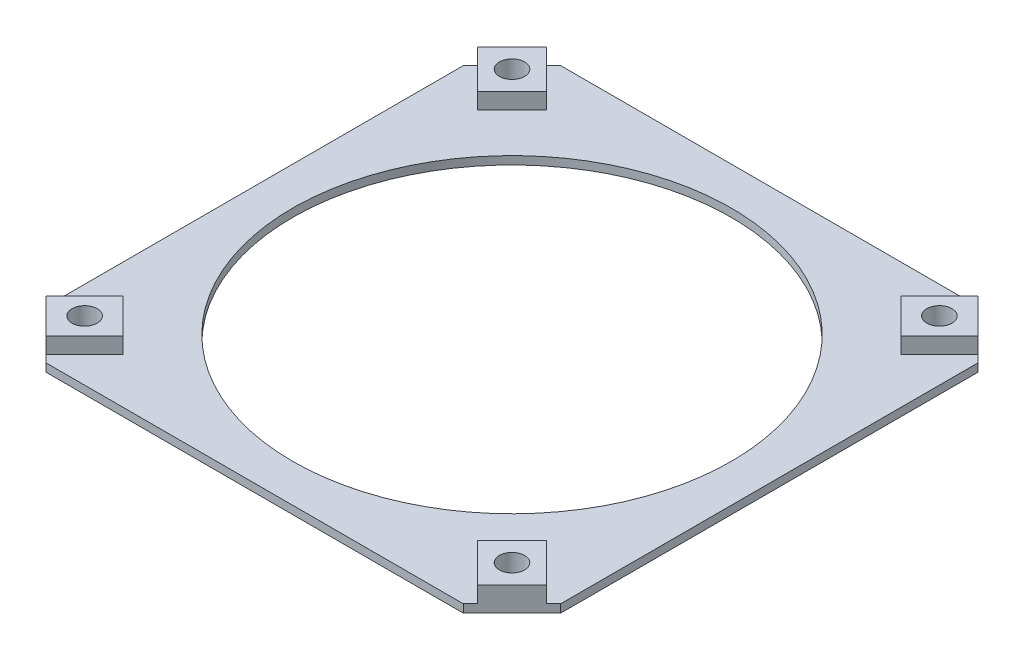
from build123d import *

# Parameters (mm, degrees)
SKETCH1_R            = 27
BOSS_EXTRUDE1_DEPTH  = 1
BOSS_EXTRUDE2_DEPTH  = 2
M3_CLEARANCE_HOLE1_D = 3.1
CIRPATTERN1_COUNT    = 4


with BuildPart() as part:
    # Sketch1 → Boss-Extrude1 (new body)
    with BuildSketch(Plane(origin=(0, 0, 0), x_dir=(1, 0, 0), z_dir=(0, 1, 0))):
        Polygon((31.68, 25.68), (25.68, 31.68), (-25.68, 31.68), (-31.68, 25.68), (-31.68, -25.68), (-25.68, -31.68), (25.68, -31.68), (31.68, -25.68), align=None)
        with Locations(Location((0, 0, 0), (0, 0, 270))):
            Circle(SKETCH1_R, mode=Mode.SUBTRACT)
    extrude(amount=BOSS_EXTRUDE1_DEPTH)

    # Sketch2 → Boss-Extrude2 (add)
    with BuildSketch(Plane(origin=(0, 1, 0), x_dir=(1, 0, 0), z_dir=(0, 1, 0))):
        Polygon((30.801320344, 26.558679656), (26.050064864, 21.807424177), (21.807424177, 26.050064864), (26.558679656, 30.801320344), align=None)
        Polygon((30.801320344, -26.558679656), (26.050064864, -21.807424177), (21.807424177, -26.050064864), (26.558679656, -30.801320344), align=None)
        Polygon((-26.558679656, -30.801320344), (-21.807424177, -26.050064864), (-26.050064864, -21.807424177), (-30.801320344, -26.558679656), align=None)
        Polygon((-30.801320344, 26.558679656), (-26.050064864, 21.807424177), (-21.807424177, 26.050064864), (-26.558679656, 30.801320344), align=None)
    extrude(amount=BOSS_EXTRUDE2_DEPTH)

    # M3 Clearance Hole1 (through all)
    with Locations(Plane(origin=(0, 3, 0), x_dir=(1, 0, 0), z_dir=(0, 1, 0))):
        with Locations((26.30437226, 26.30437226)):
            m3_clearance_hole1 = Hole(M3_CLEARANCE_HOLE1_D / 2)

    # CirPattern1: M3 Clearance Hole1 ×4 about axis
    cirpattern1_axis = Axis((0, 0, 0), (0, 1, 0))
    for i in range(1, CIRPATTERN1_COUNT):
        add(m3_clearance_hole1.rotate(cirpattern1_axis, i * 360 / CIRPATTERN1_COUNT), mode=Mode.SUBTRACT)


solid = part.part
